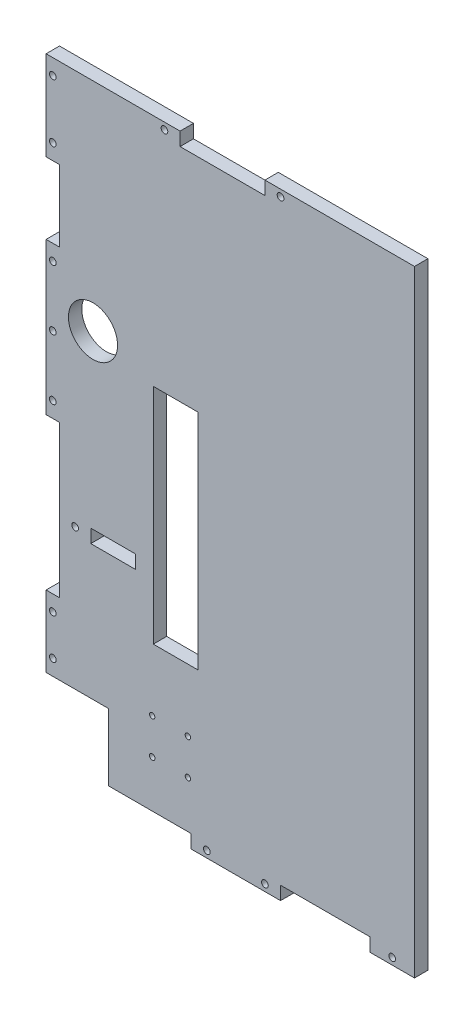
from build123d import *

# Parameters (mm, degrees)
ESQUISSE1_W             = 165
ESQUISSE1_H             = 276
BOSS_EXTRU_1_DEPTH      = 6
ESQUISSE2_W             = 38
ESQUISSE2_H             = 6
ESQUISSE2_W_2           = 6
ESQUISSE2_H_2           = 32
ESQUISSE2_H_3           = 68
ESQUISSE2_W_3           = 40
EXTERIEUR_DEPTH         = 10
ESQUISSE3_R             = 11
ESQUISSE3_W             = 20
ESQUISSE3_H             = 6
ENL_V_MAT_EXTRU_2_DEPTH = 322.616230934
ESQUISSE4_R             = 1.5
ESQUISSE4_R_2           = 1.252769876
ESQUISSE4_R_3           = 1.193016672
ESQUISSE4_R_4           = 1.226747293
ESQUISSE4_R_5           = 1.185631844
ENL_V_MAT_EXTRU_3_DEPTH = 322.616230934
ESQUISSE5_R             = 2.995
ESQUISSE5_R_2           = 3
ESQUISSE5_R_3           = 2
ENL_V_MAT_EXTRU_4_DEPTH = 3
ESQUISSE6_W             = 20
ESQUISSE6_H             = 100
ENL_V_MAT_EXTRU_5_DEPTH = 322.616230934


with BuildPart() as part:
    # Esquisse1 → Boss.-Extru.1 (new body)
    with BuildSketch(Plane.XY):
        with Locations((-82.5, 138)):
            Rectangle(ESQUISSE1_W, ESQUISSE1_H)
    extrude(amount=BOSS_EXTRU_1_DEPTH)

    # Esquisse2 → exterieur (cut)
    with BuildSketch(Plane.XY.offset(6)):
        with Locations((-86, 273)):
            Rectangle(ESQUISSE2_W, ESQUISSE2_H)
        with Locations((-162, 220)):
            Rectangle(ESQUISSE2_W_2, ESQUISSE2_H_2)
        with Locations((-162, 102)):
            Rectangle(ESQUISSE2_W_2, ESQUISSE2_H_3)
        Polygon((-137, 36), (-137, 6), (-100, 6), (-100, 0), (-165, 0), (-165, 36), align=None)
        with Locations((-40, 3)):
            Rectangle(ESQUISSE2_W_3, ESQUISSE2_H)
    extrude(amount=-EXTERIEUR_DEPTH, mode=Mode.SUBTRACT)

    # Esquisse3 → Enlèv. mat.-Extru.2 (cut, through all)
    with BuildSketch(Plane.XY.offset(6)):
        with Locations((-144, 178.92)):
            Circle(ESQUISSE3_R)
        with Locations((-135, 99)):
            Rectangle(ESQUISSE3_W, ESQUISSE3_H)
    extrude(amount=-ENL_V_MAT_EXTRU_2_DEPTH, mode=Mode.SUBTRACT)

    # Esquisse4 → Enlèv. mat.-Extru.3 (cut, through all)
    with BuildSketch(Plane.XY.offset(6)):
        with Locations((-60, 273)):
            Circle(ESQUISSE4_R)
        with Locations((-112, 273)):
            Circle(ESQUISSE4_R)
        with Locations((-162, 197)):
            Circle(ESQUISSE4_R)
        with Locations((-162, 170)):
            Circle(ESQUISSE4_R)
        with Locations((-162, 143)):
            Circle(ESQUISSE4_R)
        with Locations((-162, 61)):
            Circle(ESQUISSE4_R)
        with Locations((-162, 43)):
            Circle(ESQUISSE4_R)
        with Locations((-93, 3)):
            Circle(ESQUISSE4_R)
        with Locations((-67, 3)):
            Circle(ESQUISSE4_R)
        with Locations((-10, 3)):
            Circle(ESQUISSE4_R)
        with Locations((-162, 269)):
            Circle(ESQUISSE4_R)
        with Locations((-162, 243)):
            Circle(ESQUISSE4_R)
        with Locations((-117.5, 27)):
            Circle(ESQUISSE4_R_2)
        with Locations((-117.5, 43)):
            Circle(ESQUISSE4_R_3)
        with Locations((-101.5, 43)):
            Circle(ESQUISSE4_R_4)
        with Locations((-101.5, 27)):
            Circle(ESQUISSE4_R_5)
        with Locations((-152, 99)):
            Circle(ESQUISSE4_R)
    extrude(amount=-ENL_V_MAT_EXTRU_3_DEPTH, mode=Mode.SUBTRACT)

    # Esquisse5 → Enlèv. mat.-Extru.4 (cut)
    with BuildSketch(Plane(origin=(0, 0, 0), x_dir=(-1, 0, 0), z_dir=(0, 0, -1))):
        with Locations((60, 273)):
            Circle(ESQUISSE5_R)
        with Locations((112, 273)):
            Circle(ESQUISSE5_R)
        with Locations((162, 197)):
            Circle(ESQUISSE5_R)
        with Locations((162, 170)):
            Circle(ESQUISSE5_R)
        with Locations((162, 143)):
            Circle(ESQUISSE5_R)
        with Locations((162, 61)):
            Circle(ESQUISSE5_R)
        with Locations((162, 43)):
            Circle(ESQUISSE5_R)
        with Locations((93, 3)):
            Circle(ESQUISSE5_R)
        with Locations((67, 3)):
            Circle(ESQUISSE5_R)
        with Locations((10, 3)):
            Circle(ESQUISSE5_R)
        with Locations((162, 269)):
            Circle(ESQUISSE5_R)
        with Locations((162, 243)):
            Circle(ESQUISSE5_R)
        with Locations((152, 99)):
            Circle(ESQUISSE5_R_2)
        with Locations((117.5, 43)):
            Circle(ESQUISSE5_R_3)
        with Locations((117.5, 27)):
            Circle(ESQUISSE5_R_3)
        with Locations((101.5, 27)):
            Circle(ESQUISSE5_R_3)
        with Locations((101.5, 43)):
            Circle(ESQUISSE5_R_3)
    extrude(amount=-ENL_V_MAT_EXTRU_4_DEPTH, mode=Mode.SUBTRACT)

    # Esquisse6 → Enlèv. mat.-Extru.5 (cut, through all)
    with BuildSketch(Plane(origin=(0, 0, 0), x_dir=(-1, 0, 0), z_dir=(0, 0, -1))):
        with Locations((107, 121)):
            Rectangle(ESQUISSE6_W, ESQUISSE6_H)
    extrude(amount=-ENL_V_MAT_EXTRU_5_DEPTH, mode=Mode.SUBTRACT)


solid = part.part
